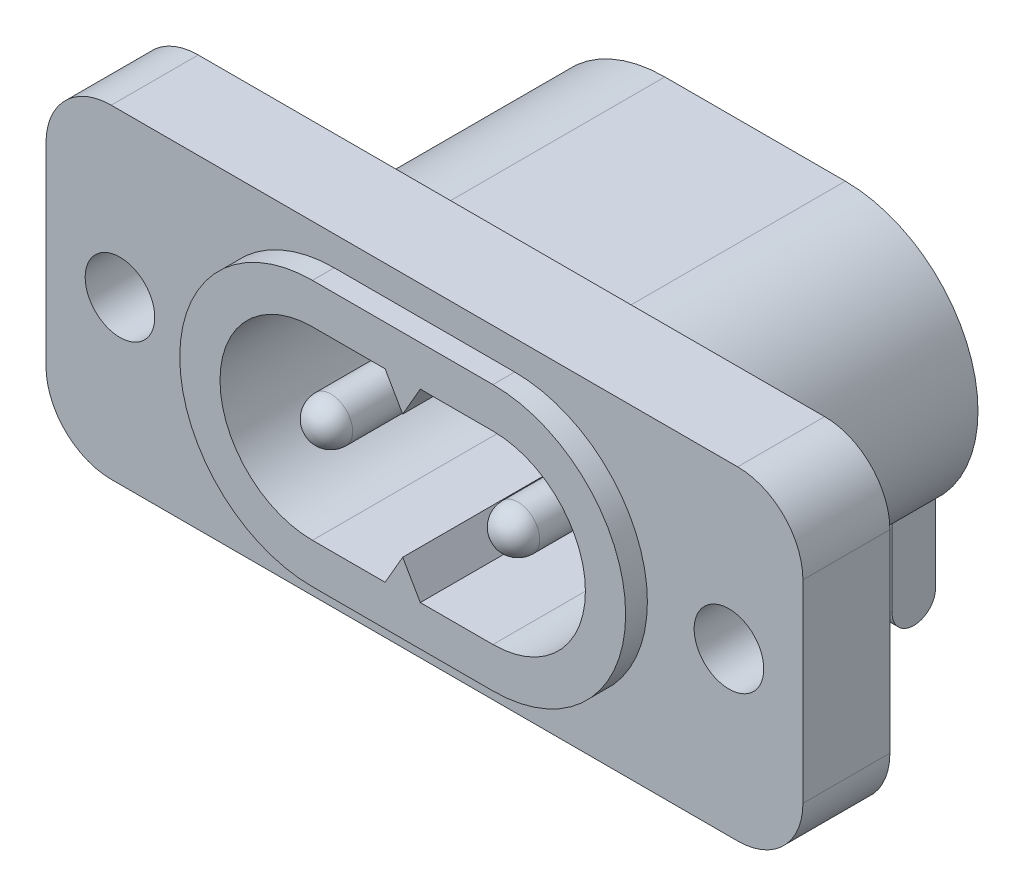
from build123d import *

# Parameters (mm, degrees)
SKETCH1_R                = 1.6
BOSS_EXTRUDE1_DEPTH      = 2
BOSS_EXTRUDE2_DEPTH      = 1
BOSS_EXTRUDE2_DEPTH_BACK = 15.2
BOSS_EXTRUDE3_START      = -9.8
BOSS_EXTRUDE3_DEPTH      = 1
BOSS_EXTRUDE4_START      = 5.2
BOSS_EXTRUDE4_DEPTH      = 0.5
BOSS_EXTRUDE6_DEPTH      = 1
SKETCH6_R                = 1
BOSS_EXTRUDE7_DEPTH      = 8.8
FILLET1_R                = 1


with BuildPart() as part:
    # Sketch1 → Boss-Extrude1 (new, symmetric)
    with BuildSketch(Plane.XY):
        with BuildLine():
            Line((-14.4, 7.45), (14.4, 7.45))
            ThreePointArc((14.4, 7.45), (16.521320344, 6.571320344), (17.4, 4.45))
            Line((17.4, 4.45), (17.4, -4.45))
            ThreePointArc((17.4, -4.45), (16.521320344, -6.571320344), (14.4, -7.45))
            Line((14.4, -7.45), (-14.4, -7.45))
            ThreePointArc((-14.4, -7.45), (-16.521320344, -6.571320344), (-17.4, -4.45))
            Line((-17.4, -4.45), (-17.4, 4.45))
            ThreePointArc((-17.4, 4.45), (-16.521320344, 6.571320344), (-14.4, 7.45))
        make_face()
        with Locations((14, 0)):
            Circle(SKETCH1_R, mode=Mode.SUBTRACT)
        with Locations(Location((-14, 0, 0), (0, 0, 180))):
            Circle(SKETCH1_R, mode=Mode.SUBTRACT)
        with BuildLine():
            Line((-4.15, 4.25), (-0.808290377, 4.25))
            Line((-0.808290377, 4.25), (0, 2.85))
            Line((0, 2.85), (0.808290377, 4.25))
            Line((0.808290377, 4.25), (4.15, 4.25))
            ThreePointArc((4.15, 4.25), (8.4, 0), (4.15, -4.25))
            Line((4.15, -4.25), (0.808290377, -4.25))
            Line((0.808290377, -4.25), (0, -2.85))
            Line((0, -2.85), (-0.808290377, -4.25))
            Line((-0.808290377, -4.25), (-4.15, -4.25))
            ThreePointArc((-4.15, -4.25), (-8.4, 0), (-4.15, 4.25))
        make_face(mode=Mode.SUBTRACT)
    extrude(amount=BOSS_EXTRUDE1_DEPTH, both=True)

    # Sketch2 → Boss-Extrude2 (add, two sides: drawn at the far end of the back side and taken through both)
    with BuildSketch(Plane.XY.offset(2).offset(-BOSS_EXTRUDE2_DEPTH_BACK)):
        with BuildLine():
            Line((-4.15, 6.1), (4.15, 6.1))
            ThreePointArc((4.15, 6.1), (10.25, 0), (4.15, -6.1))
            Line((4.15, -6.1), (-4.15, -6.1))
            ThreePointArc((-4.15, -6.1), (-10.25, 0), (-4.15, 6.1))
        make_face()
        with BuildLine():
            Line((0.808290377, 4.25), (0, 2.85))
            Line((0, 2.85), (-0.808290377, 4.25))
            Line((-0.808290377, 4.25), (-4.15, 4.25))
            ThreePointArc((-4.15, 4.25), (-8.4, 0), (-4.15, -4.25))
            Line((-4.15, -4.25), (-0.808290377, -4.25))
            Line((-0.808290377, -4.25), (0, -2.85))
            Line((0, -2.85), (0.808290377, -4.25))
            Line((0.808290377, -4.25), (4.15, -4.25))
            ThreePointArc((4.15, -4.25), (8.4, 0), (4.15, 4.25))
            Line((4.15, 4.25), (0.808290377, 4.25))
        make_face(mode=Mode.SUBTRACT)
    extrude(amount=BOSS_EXTRUDE2_DEPTH + BOSS_EXTRUDE2_DEPTH_BACK)

    # Sketch3 → Boss-Extrude3 (add)
    with BuildSketch(Plane.XY.offset(3).offset(BOSS_EXTRUDE3_START)):
        with BuildLine():
            Line((0.808290377, 4.25), (0, 2.85))
            Line((0, 2.85), (-0.808290377, 4.25))
            Line((-0.808290377, 4.25), (-4.15, 4.25))
            ThreePointArc((-4.15, 4.25), (-8.4, 0), (-4.15, -4.25))
            Line((-4.15, -4.25), (-0.808290377, -4.25))
            Line((-0.808290377, -4.25), (0, -2.85))
            Line((0, -2.85), (0.808290377, -4.25))
            Line((0.808290377, -4.25), (4.15, -4.25))
            ThreePointArc((4.15, -4.25), (8.4, 0), (4.15, 4.25))
            Line((4.15, 4.25), (0.808290377, 4.25))
        make_face()
    extrude(amount=BOSS_EXTRUDE3_DEPTH)



with BuildPart() as body_2:
    # Sketch4 → Boss-Extrude4 (new, symmetric)
    with BuildSketch(Plane(origin=(0, 0, 0), x_dir=(0, 0, -1), z_dir=(1, 0, 0)).offset(BOSS_EXTRUDE4_START)):
        with BuildLine():
            Line((13.2, 1), (15.8, 1))
            Line((15.8, 1), (15.8, -10.62))
            ThreePointArc((15.8, -10.62), (14.8, -11.62), (13.8, -10.62))
            Line((13.8, -10.62), (13.8, -1))
            Line((13.8, -1), (13.2, -1))
            Line((13.2, -1), (13.2, 1))
        make_face()
    boss_extrude4 = extrude(amount=BOSS_EXTRUDE4_DEPTH, both=True)


with BuildPart() as part_1:
    add(part.part)

    add(body_2.part)  # Boss-Extrude6 merges body 2
    # Sketch5 → Boss-Extrude6 (add)
    with BuildSketch(Plane(origin=(0, 0, -13.2), x_dir=(-1, 0, 0), z_dir=(0, 0, -1))):
        with BuildLine():
            Line((4.15, 6.1), (-4.15, 6.1))
            ThreePointArc((-4.15, 6.1), (-10.25, 0), (-4.15, -6.1))
            Line((-4.15, -6.1), (4.15, -6.1))
            ThreePointArc((4.15, -6.1), (10.25, 0), (4.15, 6.1))
        make_face()
    extrude(amount=-BOSS_EXTRUDE6_DEPTH)

    # Mirror2: Boss-Extrude4 across plane
    add(boss_extrude4.mirror(Plane(origin=(0, 0, 0), x_dir=(0, 0, 1), z_dir=(1, 0, 0))))

    # Sketch6 → Boss-Extrude7 (add)
    with BuildSketch(Plane.XY.offset(-5.8)):
        with Locations((-4.3, 0)):
            Circle(SKETCH6_R)
        with Locations(Location((4.3, 0, 0), (0, 0, 180))):
            Circle(SKETCH6_R)
    extrude(amount=BOSS_EXTRUDE7_DEPTH)

    # Fillet1
    fillet1_edges = [part_1.edges().sort_by_distance(p)[0] for p in [
        (-5.3, 0, 3),
        (5.3, 0, 3),
    ]]
    fillet(fillet1_edges, radius=FILLET1_R)


solid = part_1.part
